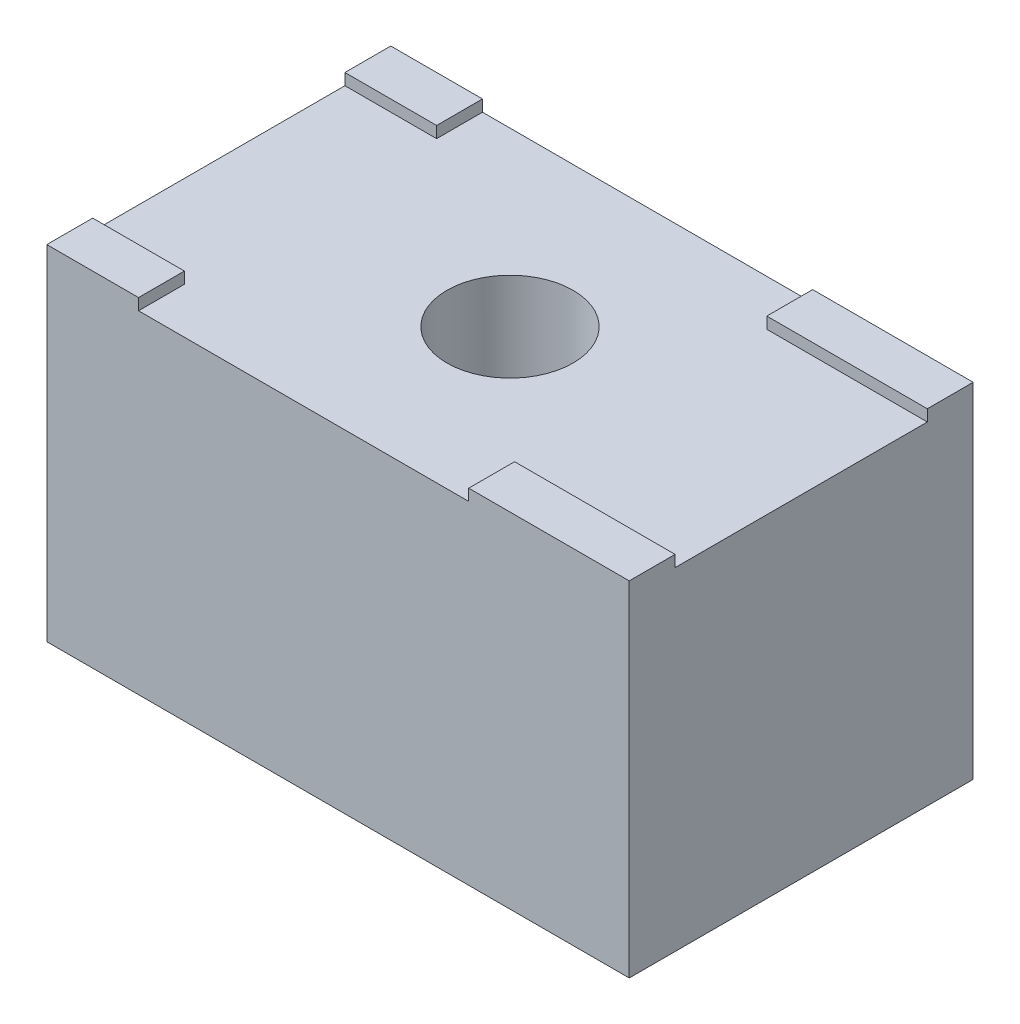
from build123d import *

# Parameters (mm, degrees)
SKETCH1_W           = 15
SKETCH1_H           = 15
BOSS_EXTRUDE1_DEPTH = 25.4
SKETCH2_R           = 2.75
CUT_EXTRUDE1_DEPTH  = 31.436984082
SKETCH3_W           = 10
SKETCH3_H           = 6.858
SKETCH3_R           = 1.5875
CUT_EXTRUDE2_DEPTH  = 1.778
FILLET1_R           = 0.79375
CUT_EXTRUDE3_DEPTH  = 0.5


with BuildPart() as part:
    # Sketch1 → Boss-Extrude1 (new body)
    with BuildSketch(Plane(origin=(0, 0, 0), x_dir=(0, 0, -1), z_dir=(1, 0, 0))):
        Rectangle(SKETCH1_W, SKETCH1_H)
    extrude(amount=BOSS_EXTRUDE1_DEPTH)

    # Sketch2 → Cut-Extrude1 (cut, through all)
    with BuildSketch(Plane(origin=(0, 7.5, 0), x_dir=(1, 0, 0), z_dir=(0, 1, 0))):
        with Locations(Location((12.7, 0, 0), (0, 0, 270))):
            Circle(SKETCH2_R)
    extrude(amount=-CUT_EXTRUDE1_DEPTH, mode=Mode.SUBTRACT)

    # Sketch3 → Cut-Extrude2 (cut)
    with BuildSketch(Plane(origin=(0, 0, -7.5), x_dir=(-1, 0, 0), z_dir=(0, 0, -1))):
        with Locations((-5, 0.071)):
            Rectangle(SKETCH3_W, SKETCH3_H)
        with Locations(Location((-4.92, 0.071, 0), (0, 0, 90))):
            Circle(SKETCH3_R, mode=Mode.SUBTRACT)
    extrude(amount=-CUT_EXTRUDE2_DEPTH, mode=Mode.SUBTRACT)

    # Fillet1
    fillet1_edges = [part.edges().sort_by_distance(p)[0] for p in [
        (10, -3.358, -6.611),
        (10, 3.5, -6.611),
    ]]
    fillet(fillet1_edges, radius=FILLET1_R)

    # Sketch7 → Cut-Extrude3 (cut)
    with BuildSketch(Plane(origin=(0, 7.5, 0), x_dir=(1, 0, 0), z_dir=(0, 1, 0))):
        Polygon((4, 7.5), (18.4, 7.5), (18.4, 5.5), (25.4, 5.5), (25.4, -5.5), (18.4, -5.5), (18.4, -7.5), (4, -7.5), (4, -5.5), (0, -5.5), (0, 5.5), (4, 5.5), align=None)
    extrude(amount=-CUT_EXTRUDE3_DEPTH, mode=Mode.SUBTRACT)


solid = part.part
